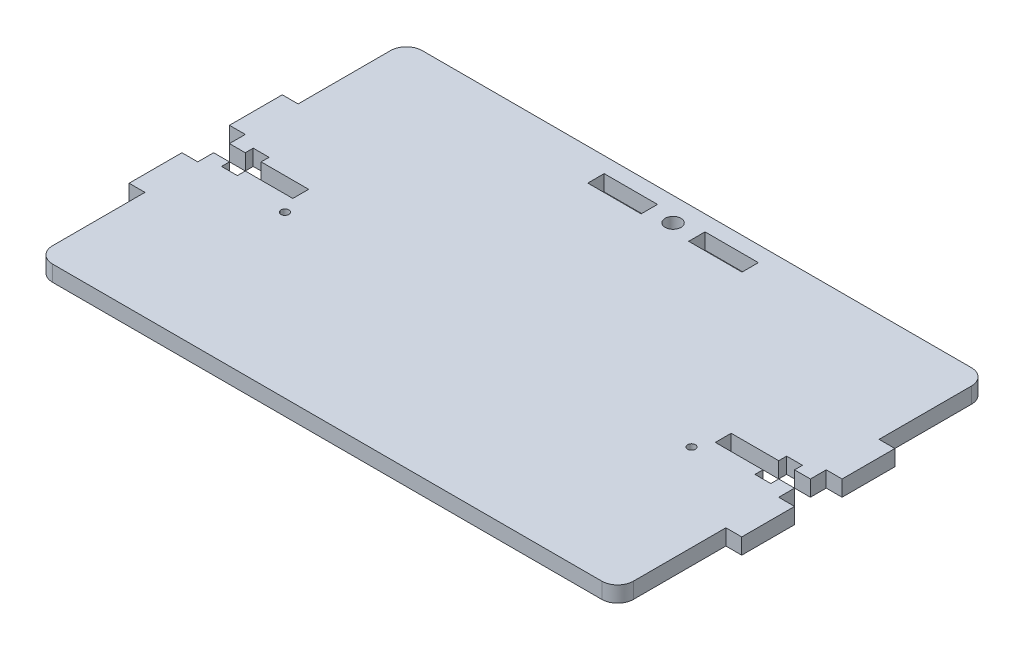
from build123d import *

# Parameters (mm, degrees)
SKETCH1_R           = 0.75
SKETCH1_W           = 10.1
SKETCH1_H           = 3.1
SKETCH1_R_2         = 1.5
BOSS_EXTRUDE1_DEPTH = 3
FILLET1_R           = 3


with BuildPart() as part:
    # Sketch1 → Boss-Extrude1 (new body)
    with BuildSketch(Plane(origin=(0, 0, 0), x_dir=(1, 0, 0), z_dir=(0, 1, 0))):
        Polygon((0, 20.5), (0, 0), (110, 0), (110, 20.5), (113, 20.5), (113, 30.5), (110, 30.5), (110, 33.5), (107, 33.5), (107, 32), (104, 32), (104, 33.5), (95, 33.5), (95, 36.5), (104, 36.5), (104, 38), (107, 38), (107, 36.5), (110, 36.5), (110, 39.5), (113, 39.5), (113, 49.5), (110, 49.5), (110, 70), (0, 70), (0, 49.5), (-3, 49.5), (-3, 39.5), (0, 39.5), (0, 36.5), (3, 36.5), (3, 38), (6, 38), (6, 36.5), (15, 36.5), (15, 33.5), (6, 33.5), (6, 32), (3, 32), (3, 33.5), (0, 33.5), (0, 30.5), (-3, 30.5), (-3, 20.5), align=None)
        with Locations(Location((16.5, 30.5, 0), (0, 0, 270))):
            Circle(SKETCH1_R, mode=Mode.SUBTRACT)
        with Locations(Location((93.5, 30.5, 0), (0, 0, 270))):
            Circle(SKETCH1_R, mode=Mode.SUBTRACT)
        with Locations((45.45, 65.5)):
            Rectangle(SKETCH1_W, SKETCH1_H, mode=Mode.SUBTRACT)
        with Locations(Location((55, 65.5, 0), (0, 0, 270))):
            Circle(SKETCH1_R_2, mode=Mode.SUBTRACT)
        with Locations((64.55, 65.5)):
            Rectangle(SKETCH1_W, SKETCH1_H, mode=Mode.SUBTRACT)
    extrude(amount=BOSS_EXTRUDE1_DEPTH)

    # Fillet1
    fillet1_edges = [part.edges().sort_by_distance(p)[0] for p in [
        (110, 1.5, 0),
        (0, 1.5, 0),
        (0, 1.5, -70),
        (110, 1.5, -70),
    ]]
    fillet(fillet1_edges, radius=FILLET1_R)


solid = part.part
